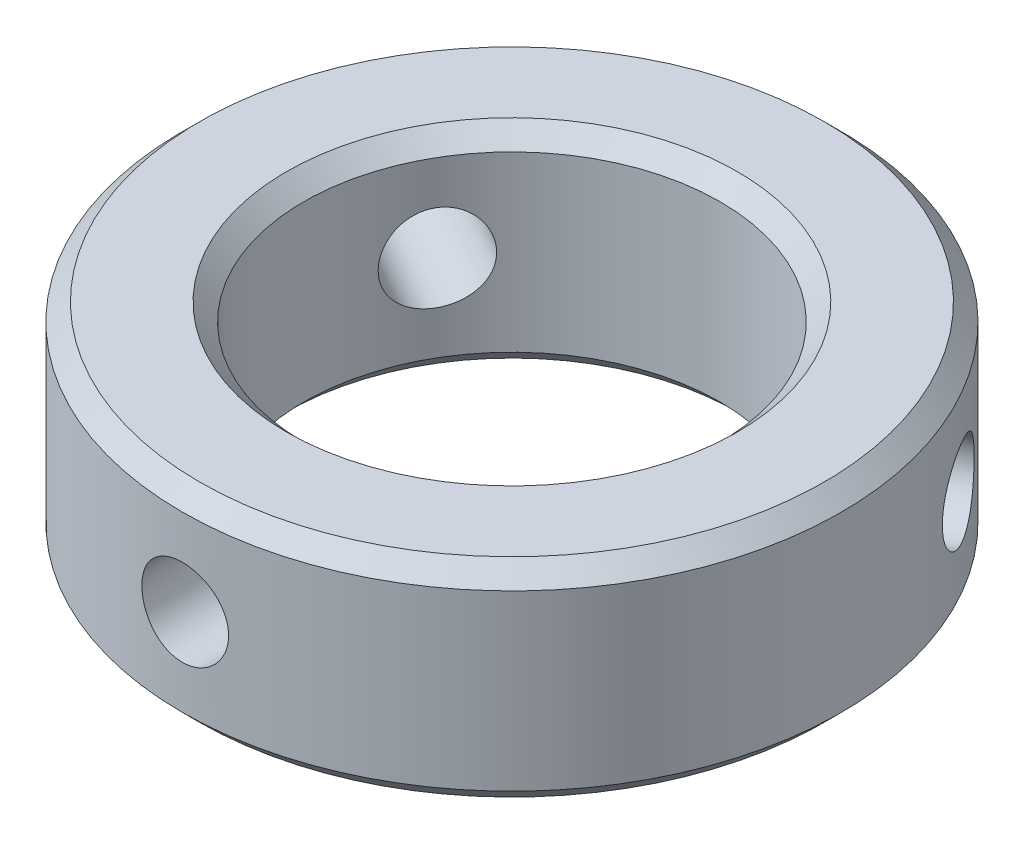
from build123d import *

# Parameters (mm, degrees)
CROQUIS1_R              = 9.5
CROQUIS1_R_2            = 6
SALIENTE_EXTRUIR1_DEPTH = 6
MATRIZC1_COUNT          = 3
CHAFL_N1_SIZE           = 0.5
CHAFL_N2_SIZE           = 0.5


with BuildPart() as part:
    # Croquis1 → Saliente-Extruir1 (new body)
    with BuildSketch(Plane(origin=(0, 0, 0), x_dir=(1, 0, 0), z_dir=(0, 1, 0))):
        with Locations(Location((0, 0, 0), (0, 0, 270))):
            Circle(CROQUIS1_R)
        with Locations(Location((0, 0, 0), (0, 0, 270))):
            Circle(CROQUIS1_R_2, mode=Mode.SUBTRACT)
    extrude(amount=SALIENTE_EXTRUIR1_DEPTH)

    # Croquis3 → Taladro roscado M31 (revolve, cut)
    with BuildSketch(Plane(origin=(0, 3, 9.5), x_dir=(0, -1, 0), z_dir=(1, 0, 0))):
        Polygon((0, 0), (0, 9.251075774), (1.25, 8.5), (1.25, 0), align=None)
    taladro_roscado_m31 = revolve(axis=Axis((0, 3, 15.85), (0, 0, -1)), mode=Mode.SUBTRACT)

    # MatrizC1: Taladro roscado M31 ×3 about axis
    matrizc1_axis = Axis((0, 0, 0), (0, 1, 0))
    for i in range(1, MATRIZC1_COUNT):
        add(taladro_roscado_m31.rotate(matrizc1_axis, i * 360 / MATRIZC1_COUNT), mode=Mode.SUBTRACT)

    # Chaflán1
    chafl_n1_edges = [part.edges().sort_by_distance(p)[0] for p in [
        (0, 0, -6),
        (0, 6, -6),
    ]]
    chamfer(chafl_n1_edges, length=CHAFL_N1_SIZE)

    # Chaflán2
    chafl_n2_edges = [part.edges().sort_by_distance(p)[0] for p in [
        (0, 0, -9.5),
        (0, 6, -9.5),
    ]]
    chamfer(chafl_n2_edges, length=CHAFL_N2_SIZE)


solid = part.part
